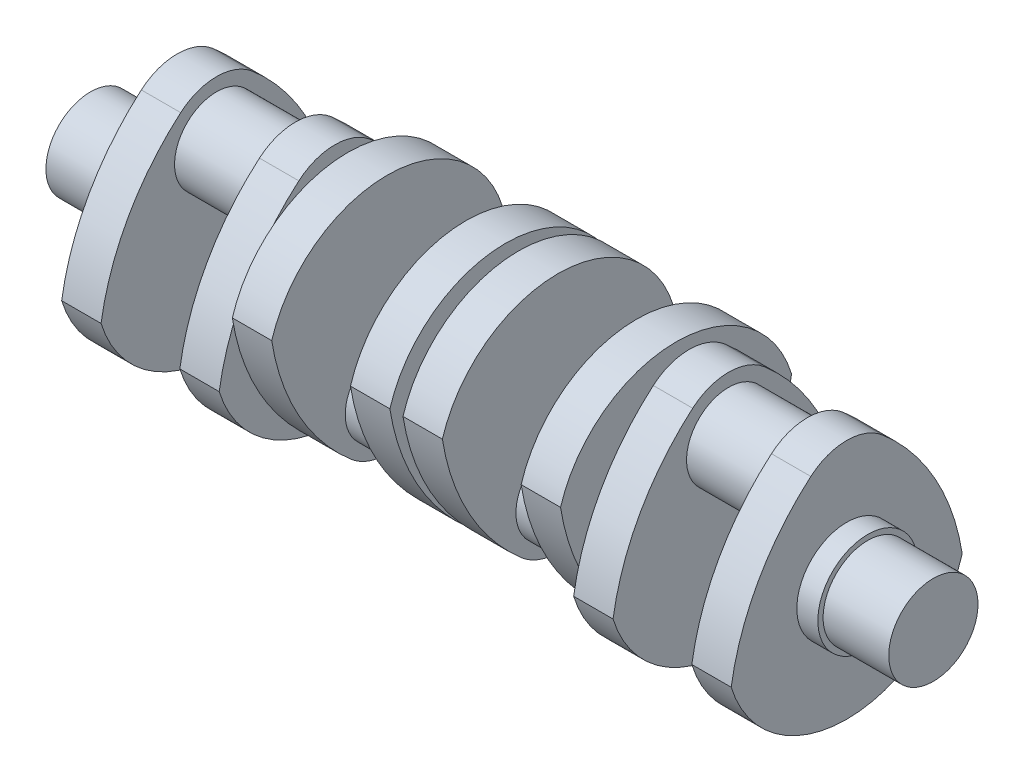
from build123d import *

# Parameters (mm, degrees)
SKETCH2_R           = 17
BOSS_EXTRUDE1_DEPTH = 25
SKETCH2_4_R         = 19
BOSS_EXTRUDE2_DEPTH = 8
BOSS_EXTRUDE3_DEPTH = 15
SKETCH5_R           = 16
BOSS_EXTRUDE4_DEPTH = 15
BOSS_EXTRUDE5_START = 5
SKETCH6_R           = 17
BOSS_EXTRUDE5_DEPTH = 5
BOSS_EXTRUDE6_DEPTH = 15
SKETCH8_R           = 16
BOSS_EXTRUDE7_DEPTH = 30
BOSS_EXTRUDE8_DEPTH = 15
BOSS_EXTRUDE9_START = 2.5
SKETCH10_R          = 17
BOSS_EXTRUDE9_DEPTH = 2.5


with BuildPart() as part:
    # Sketch2 → Boss-Extrude1 (new body)
    with BuildSketch(Plane(origin=(0, 0, 0), x_dir=(0, 0, -1), z_dir=(1, 0, 0))):
        Circle(SKETCH2_R)
    extrude(amount=-BOSS_EXTRUDE1_DEPTH)

    # Sketch2<4> → Boss-Extrude2 (add)
    with BuildSketch(Plane(origin=(0, 0, 0), x_dir=(0, 0, -1), z_dir=(1, 0, 0))):
        Circle(SKETCH2_4_R)
    extrude(amount=BOSS_EXTRUDE2_DEPTH)

    # Sketch4 → Boss-Extrude3 (add)
    with BuildSketch(Plane(origin=(8, 0, 0), x_dir=(0, 0, -1), z_dir=(1, 0, 0))):
        with BuildLine():
            ThreePointArc((-13.668094758, 40.943123461), (0, 46), (13.668094758, 40.943123461))
            ThreePointArc((13.668094758, 40.943123461), (33.683444249, 16.469257624), (44, -13.416407865))
            ThreePointArc((44, -13.416407865), (0, -46), (-44, -13.416407865))
            ThreePointArc((-44, -13.416407865), (-33.683444249, 16.469257624), (-13.668094758, 40.943123461))
        make_face()
    boss_extrude3 = extrude(amount=BOSS_EXTRUDE3_DEPTH)

    # Sketch5 → Boss-Extrude4 (add)
    with BuildSketch(Plane(origin=(23, 0, 0), x_dir=(0, 0, -1), z_dir=(1, 0, 0))):
        with Locations((0, 25)):
            Circle(SKETCH5_R)
    boss_extrude4 = extrude(amount=BOSS_EXTRUDE4_DEPTH)

    # Mirror1: Boss-Extrude3, Boss-Extrude4 across plane
    add(boss_extrude3.mirror(Plane(origin=(38, 25, 0), x_dir=(0, 0, 1), z_dir=(1, 0, 0))))
    add(boss_extrude4.mirror(Plane(origin=(38, 25, 0), x_dir=(0, 0, 1), z_dir=(1, 0, 0))))

    # Sketch6 → Boss-Extrude5 (add)
    with BuildSketch(Plane(origin=(68, 0, 0), x_dir=(0, 0, -1), z_dir=(1, 0, 0)).offset(BOSS_EXTRUDE5_START)):
        Circle(SKETCH6_R)
    extrude(amount=-BOSS_EXTRUDE5_DEPTH)

    # Sketch7 → Boss-Extrude6 (add)
    with BuildSketch(Plane(origin=(73, 0, 0), x_dir=(0, 0, -1), z_dir=(1, 0, 0))):
        with BuildLine():
            ThreePointArc((-13.668094758, -40.943123461), (0, -46), (13.668094758, -40.943123461))
            ThreePointArc((13.668094758, -40.943123461), (33.683444249, -16.469257624), (44, 13.416407865))
            ThreePointArc((44, 13.416407865), (0, 46), (-44, 13.416407865))
            ThreePointArc((-44, 13.416407865), (-33.683444249, -16.469257624), (-13.668094758, -40.943123461))
        make_face()
    extrude(amount=BOSS_EXTRUDE6_DEPTH)

    # Sketch8 → Boss-Extrude7 (add)
    with BuildSketch(Plane(origin=(88, 0, 0), x_dir=(0, 0, -1), z_dir=(1, 0, 0))):
        with Locations((0, -25)):
            Circle(SKETCH8_R)
    extrude(amount=BOSS_EXTRUDE7_DEPTH)

    # Sketch9 → Boss-Extrude8 (add)
    with BuildSketch(Plane(origin=(118, 0, 0), x_dir=(0, 0, -1), z_dir=(1, 0, 0))):
        with BuildLine():
            ThreePointArc((-13.668094758, -40.943123461), (0, -46), (13.668094758, -40.943123461))
            ThreePointArc((13.668094758, -40.943123461), (33.683444249, -16.469257624), (44, 13.416407865))
            ThreePointArc((44, 13.416407865), (0, 46), (-44, 13.416407865))
            ThreePointArc((-44, 13.416407865), (-33.683444249, -16.469257624), (-13.668094758, -40.943123461))
        make_face()
    extrude(amount=BOSS_EXTRUDE8_DEPTH)

    # Sketch10 → Boss-Extrude9 (add)
    with BuildSketch(Plane(origin=(133, 0, 0), x_dir=(0, 0, -1), z_dir=(1, 0, 0)).offset(BOSS_EXTRUDE9_START)):
        Circle(SKETCH10_R)
    extrude(amount=-BOSS_EXTRUDE9_DEPTH)

    # Mirror2: part across plane


with BuildPart() as part_1:
    add(part.part)
    add(part.part.mirror(Plane(origin=(135.5, 0, 0), x_dir=(0, 0, 1), z_dir=(1, 0, 0))))


solid = part_1.part
